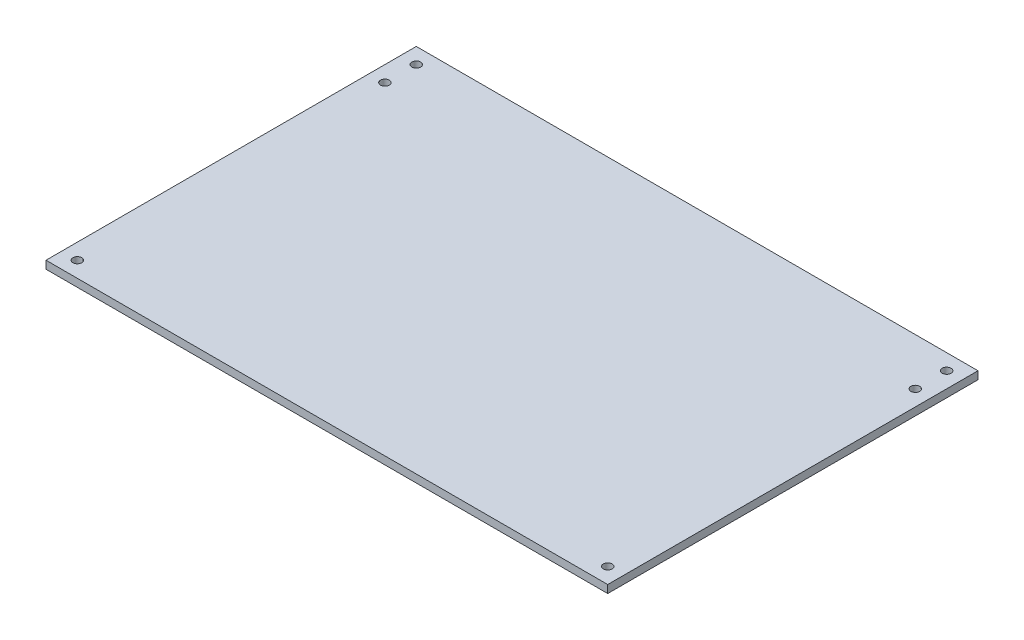
from build123d import *

# Parameters (mm, degrees)
BOSS_EXTRUDE1_START              = 19.05
SKETCH2_W                        = 600
SKETCH2_H                        = 256.45
BOSS_EXTRUDE1_DEPTH              = 6.35
BOSS_EXTRUDE2_START              = 19.05
SKETCH2_4_W                      = 455.092
SKETCH2_4_H                      = 256.45
BOSS_EXTRUDE2_DEPTH              = 6.35
BOSS_EXTRUDE3_START              = 19.05
SKETCH2_5_W                      = 455.092
SKETCH2_5_H                      = 300
BOSS_EXTRUDE3_DEPTH              = 6.35
SKETCH8_W                        = 3.5687
SKETCH8_H                        = 6.35
F_1_4_CLEARANCE_HOLE2_AT_2_COUNT = 2
F_1_4_CLEARANCE_HOLE2_AT_2_PITCH = 231.05
F_1_4_CLEARANCE_HOLE2_AT_3_COUNT = 2
F_1_4_CLEARANCE_HOLE2_AT_3_PITCH = 595.822744195
F_1_4_CLEARANCE_HOLE2_AT_4_COUNT = 2
F_1_4_CLEARANCE_HOLE2_AT_4_PITCH = 619.31354135
F_1_4_CLEARANCE_HOLE2_AT_5_COUNT = 2
F_1_4_CLEARANCE_HOLE2_AT_5_PITCH = 523.8
F_1_4_CLEARANCE_HOLE2_AT_6_COUNT = 2
F_1_4_CLEARANCE_HOLE2_AT_6_PITCH = 549.2
F_1_4_CLEARANCE_HOLE2_AT_7_COUNT = 2
F_1_4_CLEARANCE_HOLE2_AT_7_PITCH = 574.6
SKETCH10_W                       = 3.5687
SKETCH10_H                       = 6.35
F_1_4_CLEARANCE_HOLE3_AT_2_COUNT = 2
F_1_4_CLEARANCE_HOLE3_AT_2_PITCH = 25.4
F_1_4_CLEARANCE_HOLE3_AT_3_COUNT = 2
F_1_4_CLEARANCE_HOLE3_AT_3_PITCH = 50.8
F_1_4_CLEARANCE_HOLE3_AT_4_COUNT = 2
F_1_4_CLEARANCE_HOLE3_AT_4_PITCH = 231.05
F_1_4_CLEARANCE_HOLE3_AT_5_COUNT = 2
F_1_4_CLEARANCE_HOLE3_AT_5_PITCH = 487.872234672
F_1_4_CLEARANCE_HOLE3_AT_6_COUNT = 2
F_1_4_CLEARANCE_HOLE3_AT_6_PITCH = 476.368698976
F_1_4_CLEARANCE_HOLE3_AT_7_COUNT = 2
F_1_4_CLEARANCE_HOLE3_AT_7_PITCH = 429.692
SKETCH12_W                       = 3.5687
SKETCH12_H                       = 6.35
F_1_4_CLEARANCE_HOLE4_AT_2_COUNT = 2
F_1_4_CLEARANCE_HOLE4_AT_2_PITCH = 25.4
F_1_4_CLEARANCE_HOLE4_AT_3_COUNT = 2
F_1_4_CLEARANCE_HOLE4_AT_3_PITCH = 249.2
F_1_4_CLEARANCE_HOLE4_AT_4_COUNT = 2
F_1_4_CLEARANCE_HOLE4_AT_4_PITCH = 496.725130091
F_1_4_CLEARANCE_HOLE4_AT_5_COUNT = 2
F_1_4_CLEARANCE_HOLE4_AT_5_PITCH = 429.692
F_1_4_CLEARANCE_HOLE4_AT_6_COUNT = 2
F_1_4_CLEARANCE_HOLE4_AT_6_PITCH = 430.442069115
SKETCH14_W                       = 2.4892
SKETCH14_H                       = 6.35
F_8_CLEARANCE_HOLE2_AT_2_COUNT   = 2
F_8_CLEARANCE_HOLE2_AT_2_PITCH   = 128.5875
SKETCH16_W                       = 2.4892
SKETCH16_H                       = 6.35
F_8_CLEARANCE_HOLE3_AT_2_COUNT   = 2
F_8_CLEARANCE_HOLE3_AT_2_PITCH   = 128.5875
SKETCH17_R                       = 3.5687
BOSS_EXTRUDE4_DEPTH              = 6.35
FILLET2_R                        = 6.35
SKETCH18_W                       = 152.4
SKETCH18_H                       = 25.4
SKETCH18_R                       = 3.5687
BOSS_EXTRUDE5_DEPTH              = 6.35
SKETCH19_W                       = 25.4
SKETCH19_H                       = 101.6
SKETCH19_R                       = 3.5687
BOSS_EXTRUDE6_DEPTH              = 6.35


with BuildPart() as part:
    # Sketch2 → Boss-Extrude1 (new body)
    with BuildSketch(Plane(origin=(0, 0, 0), x_dir=(1, 0, 0), z_dir=(0, 1, 0)).offset(BOSS_EXTRUDE1_START)):
        with Locations((0, 278.225)):
            Rectangle(SKETCH2_W, SKETCH2_H)
    extrude(amount=BOSS_EXTRUDE1_DEPTH)

    # Sketch8 → 1/4 Clearance Hole2 (revolve, cut)
    with BuildSketch(Plane(origin=(-287.3, 25.4, -393.75), x_dir=(0, 0, 1), z_dir=(1, 0, 0))):
        with Locations((1.78435, 3.175)):
            Rectangle(SKETCH8_W, SKETCH8_H)
    f_1_4_clearance_hole2 = revolve(axis=Axis((-287.3, 31.75, -393.75), (0, -1, 0)), mode=Mode.SUBTRACT)

    # 1/4 Clearance Hole2 at 2: 1/4 Clearance Hole2 ×2
    with Locations(*[(0, 0, i * F_1_4_CLEARANCE_HOLE2_AT_2_PITCH) for i in range(1, F_1_4_CLEARANCE_HOLE2_AT_2_COUNT)]):
        add(f_1_4_clearance_hole2, mode=Mode.SUBTRACT)

    # 1/4 Clearance Hole2 at 3: 1/4 Clearance Hole2 ×2
    with Locations(*[Vector(0.9217506470687957, 0, 0.3877831154501913) * (i * F_1_4_CLEARANCE_HOLE2_AT_3_PITCH) for i in range(1, F_1_4_CLEARANCE_HOLE2_AT_3_COUNT)]):
        add(f_1_4_clearance_hole2, mode=Mode.SUBTRACT)

    # 1/4 Clearance Hole2 at 4: 1/4 Clearance Hole2 ×2
    with Locations(*[Vector(0.9278014473041833, 0, 0.37307435502894426) * (i * F_1_4_CLEARANCE_HOLE2_AT_4_PITCH) for i in range(1, F_1_4_CLEARANCE_HOLE2_AT_4_COUNT)]):
        add(f_1_4_clearance_hole2, mode=Mode.SUBTRACT)

    # 1/4 Clearance Hole2 at 5: 1/4 Clearance Hole2 ×2
    with Locations(*[(i * F_1_4_CLEARANCE_HOLE2_AT_5_PITCH, 0, 0) for i in range(1, F_1_4_CLEARANCE_HOLE2_AT_5_COUNT)]):
        add(f_1_4_clearance_hole2, mode=Mode.SUBTRACT)

    # 1/4 Clearance Hole2 at 6: 1/4 Clearance Hole2 ×2
    with Locations(*[(i * F_1_4_CLEARANCE_HOLE2_AT_6_PITCH, 0, 0) for i in range(1, F_1_4_CLEARANCE_HOLE2_AT_6_COUNT)]):
        add(f_1_4_clearance_hole2, mode=Mode.SUBTRACT)

    # 1/4 Clearance Hole2 at 7: 1/4 Clearance Hole2 ×2
    with Locations(*[(i * F_1_4_CLEARANCE_HOLE2_AT_7_PITCH, 0, 0) for i in range(1, F_1_4_CLEARANCE_HOLE2_AT_7_COUNT)]):
        add(f_1_4_clearance_hole2, mode=Mode.SUBTRACT)

    # Sketch14 → #8 Clearance Hole2 (revolve, cut)
    with BuildSketch(Plane(origin=(-268.25, 25.4, -351.68125), x_dir=(0, 0, 1), z_dir=(1, 0, 0))):
        with Locations((1.2446, 3.175)):
            Rectangle(SKETCH14_W, SKETCH14_H)
    f_8_clearance_hole2 = revolve(axis=Axis((-268.25, 31.75, -351.68125), (0, -1, 0)), mode=Mode.SUBTRACT)

    # #8 Clearance Hole2 at 2: #8 Clearance Hole2 ×2
    with Locations(*[(0, 0, i * F_8_CLEARANCE_HOLE2_AT_2_PITCH) for i in range(1, F_8_CLEARANCE_HOLE2_AT_2_COUNT)]):
        add(f_8_clearance_hole2, mode=Mode.SUBTRACT)


with BuildPart() as body_2:
    # Sketch2<4> → Boss-Extrude2 (new body)
    with BuildSketch(Plane(origin=(0, 0, 0), x_dir=(1, 0, 0), z_dir=(0, 1, 0)).offset(BOSS_EXTRUDE2_START)):
        with Locations((527.546, 278.225)):
            Rectangle(SKETCH2_4_W, SKETCH2_4_H)
    extrude(amount=BOSS_EXTRUDE2_DEPTH)

    # Sketch10 → 1/4 Clearance Hole3 (revolve, cut)
    with BuildSketch(Plane(origin=(312.7, 25.4, -393.75), x_dir=(0, 0, 1), z_dir=(1, 0, 0))):
        with Locations((1.78435, 3.175)):
            Rectangle(SKETCH10_W, SKETCH10_H)
    f_1_4_clearance_hole3 = revolve(axis=Axis((312.7, 31.75, -393.75), (0, -1, 0)), mode=Mode.SUBTRACT)

    # 1/4 Clearance Hole3 at 2: 1/4 Clearance Hole3 ×2
    with Locations(*[(i * F_1_4_CLEARANCE_HOLE3_AT_2_PITCH, 0, 0) for i in range(1, F_1_4_CLEARANCE_HOLE3_AT_2_COUNT)]):
        add(f_1_4_clearance_hole3, mode=Mode.SUBTRACT)

    # 1/4 Clearance Hole3 at 3: 1/4 Clearance Hole3 ×2
    with Locations(*[(i * F_1_4_CLEARANCE_HOLE3_AT_3_PITCH, 0, 0) for i in range(1, F_1_4_CLEARANCE_HOLE3_AT_3_COUNT)]):
        add(f_1_4_clearance_hole3, mode=Mode.SUBTRACT)

    # 1/4 Clearance Hole3 at 4: 1/4 Clearance Hole3 ×2
    with Locations(*[(0, 0, i * F_1_4_CLEARANCE_HOLE3_AT_4_PITCH) for i in range(1, F_1_4_CLEARANCE_HOLE3_AT_4_COUNT)]):
        add(f_1_4_clearance_hole3, mode=Mode.SUBTRACT)

    # 1/4 Clearance Hole3 at 5: 1/4 Clearance Hole3 ×2
    with Locations(*[Vector(0.880746985506873, 0, 0.47358710658183684) * (i * F_1_4_CLEARANCE_HOLE3_AT_5_PITCH) for i in range(1, F_1_4_CLEARANCE_HOLE3_AT_5_COUNT)]):
        add(f_1_4_clearance_hole3, mode=Mode.SUBTRACT)

    # 1/4 Clearance Hole3 at 6: 1/4 Clearance Hole3 ×2
    with Locations(*[Vector(0.9020156045595491, 0, 0.4317034272866863) * (i * F_1_4_CLEARANCE_HOLE3_AT_6_PITCH) for i in range(1, F_1_4_CLEARANCE_HOLE3_AT_6_COUNT)]):
        add(f_1_4_clearance_hole3, mode=Mode.SUBTRACT)

    # 1/4 Clearance Hole3 at 7: 1/4 Clearance Hole3 ×2
    with Locations(*[(i * F_1_4_CLEARANCE_HOLE3_AT_7_PITCH, 0, 0) for i in range(1, F_1_4_CLEARANCE_HOLE3_AT_7_COUNT)]):
        add(f_1_4_clearance_hole3, mode=Mode.SUBTRACT)

    # Sketch16 → #8 Clearance Hole3 (revolve, cut)
    with BuildSketch(Plane(origin=(723.342, 25.4, -351.68125), x_dir=(0, 0, 1), z_dir=(1, 0, 0))):
        with Locations((1.2446, 3.175)):
            Rectangle(SKETCH16_W, SKETCH16_H)
    f_8_clearance_hole3 = revolve(axis=Axis((723.342, 31.75, -351.68125), (0, -1, 0)), mode=Mode.SUBTRACT)

    # #8 Clearance Hole3 at 2: #8 Clearance Hole3 ×2
    with Locations(*[(0, 0, i * F_8_CLEARANCE_HOLE3_AT_2_PITCH) for i in range(1, F_8_CLEARANCE_HOLE3_AT_2_COUNT)]):
        add(f_8_clearance_hole3, mode=Mode.SUBTRACT)


with BuildPart() as body_3:
    # Sketch2<5> → Boss-Extrude3 (new body)
    with BuildSketch(Plane(origin=(0, 0, 0), x_dir=(1, 0, 0), z_dir=(0, 1, 0)).offset(BOSS_EXTRUDE3_START)):
        with Locations((527.546, 0)):
            Rectangle(SKETCH2_5_W, SKETCH2_5_H)
    extrude(amount=BOSS_EXTRUDE3_DEPTH)

    # Sketch12 → 1/4 Clearance Hole4 (revolve, cut)
    with BuildSketch(Plane(origin=(312.7, 25.4, -111.9), x_dir=(0, 0, 1), z_dir=(1, 0, 0))):
        with Locations((1.78435, 3.175)):
            Rectangle(SKETCH12_W, SKETCH12_H)
    f_1_4_clearance_hole4 = revolve(axis=Axis((312.7, 31.75, -111.9), (0, -1, 0)), mode=Mode.SUBTRACT)

    # 1/4 Clearance Hole4 at 2: 1/4 Clearance Hole4 ×2
    with Locations(*[(0, 0, -i * F_1_4_CLEARANCE_HOLE4_AT_2_PITCH) for i in range(1, F_1_4_CLEARANCE_HOLE4_AT_2_COUNT)]):
        add(f_1_4_clearance_hole4, mode=Mode.SUBTRACT)

    # 1/4 Clearance Hole4 at 3: 1/4 Clearance Hole4 ×2
    with Locations(*[(0, 0, i * F_1_4_CLEARANCE_HOLE4_AT_3_PITCH) for i in range(1, F_1_4_CLEARANCE_HOLE4_AT_3_COUNT)]):
        add(f_1_4_clearance_hole4, mode=Mode.SUBTRACT)

    # 1/4 Clearance Hole4 at 4: 1/4 Clearance Hole4 ×2
    with Locations(*[Vector(0.865049851456502, 0, 0.5016859121951541) * (i * F_1_4_CLEARANCE_HOLE4_AT_4_PITCH) for i in range(1, F_1_4_CLEARANCE_HOLE4_AT_4_COUNT)]):
        add(f_1_4_clearance_hole4, mode=Mode.SUBTRACT)

    # 1/4 Clearance Hole4 at 5: 1/4 Clearance Hole4 ×2
    with Locations(*[(i * F_1_4_CLEARANCE_HOLE4_AT_5_PITCH, 0, 0) for i in range(1, F_1_4_CLEARANCE_HOLE4_AT_5_COUNT)]):
        add(f_1_4_clearance_hole4, mode=Mode.SUBTRACT)

    # 1/4 Clearance Hole4 at 6: 1/4 Clearance Hole4 ×2
    with Locations(*[Vector(0.998257444685787, 0, -0.05900910208944768) * (i * F_1_4_CLEARANCE_HOLE4_AT_6_PITCH) for i in range(1, F_1_4_CLEARANCE_HOLE4_AT_6_COUNT)]):
        add(f_1_4_clearance_hole4, mode=Mode.SUBTRACT)


with BuildPart() as body_4:
    # Sketch17 → Boss-Extrude4 (new body)
    with BuildSketch(Plane(origin=(0, 25.4, 0), x_dir=(1, 0, 0), z_dir=(0, 1, 0))):
        Polygon((249.2, 150), (249.2, 175.4), (325.4, 175.4), (325.4, 99.2), (300, 99.2), (300, 150), align=None)
        with Locations(Location((261.9, 162.7, 0), (0, 0, 270))):
            Circle(SKETCH17_R, mode=Mode.SUBTRACT)
        with Locations(Location((287.3, 162.7, 0), (0, 0, 270))):
            Circle(SKETCH17_R, mode=Mode.SUBTRACT)
        with Locations(Location((312.7, 162.7, 0), (0, 0, 270))):
            Circle(SKETCH17_R, mode=Mode.SUBTRACT)
        with Locations(Location((312.7, 137.3, 0), (0, 0, 270))):
            Circle(SKETCH17_R, mode=Mode.SUBTRACT)
        with Locations(Location((312.7, 111.9, 0), (0, 0, 270))):
            Circle(SKETCH17_R, mode=Mode.SUBTRACT)
    extrude(amount=BOSS_EXTRUDE4_DEPTH)

    # Fillet2
    fillet2_edges = [body_4.edges().sort_by_distance(p)[0] for p in [
        (249.2, 28.575, -150),
        (249.2, 28.575, -175.4),
        (325.4, 28.575, -175.4),
        (325.4, 28.575, -99.2),
        (300, 28.575, -99.2),
    ]]
    fillet(fillet2_edges, radius=FILLET2_R)


with BuildPart() as body_5:
    # Sketch18 → Boss-Extrude5 (new body)
    with BuildSketch(Plane(origin=(0, 25.4, 0), x_dir=(1, 0, 0), z_dir=(0, 1, 0))):
        with Locations((300, 393.75)):
            Rectangle(SKETCH18_W, SKETCH18_H)
        with Locations(Location((236.5, 393.75, 0), (0, 0, 270))):
            Circle(SKETCH18_R, mode=Mode.SUBTRACT)
        with Locations(Location((261.9, 393.75, 0), (0, 0, 270))):
            Circle(SKETCH18_R, mode=Mode.SUBTRACT)
        with Locations(Location((287.3, 393.75, 0), (0, 0, 270))):
            Circle(SKETCH18_R, mode=Mode.SUBTRACT)
        with Locations(Location((312.7, 393.75, 0), (0, 0, 270))):
            Circle(SKETCH18_R, mode=Mode.SUBTRACT)
        with Locations(Location((338.1, 393.75, 0), (0, 0, 270))):
            Circle(SKETCH18_R, mode=Mode.SUBTRACT)
        with Locations(Location((363.5, 393.75, 0), (0, 0, 270))):
            Circle(SKETCH18_R, mode=Mode.SUBTRACT)
    extrude(amount=BOSS_EXTRUDE5_DEPTH)


with BuildPart() as body_6:
    # Sketch19 → Boss-Extrude6 (new body)
    with BuildSketch(Plane(origin=(0, 25.4, 0), x_dir=(1, 0, 0), z_dir=(0, 1, 0))):
        with Locations((742.392, 150)):
            Rectangle(SKETCH19_W, SKETCH19_H)
        with Locations(Location((742.392, 111.9, 0), (0, 0, 270))):
            Circle(SKETCH19_R, mode=Mode.SUBTRACT)
        with Locations(Location((742.392, 137.3, 0), (0, 0, 270))):
            Circle(SKETCH19_R, mode=Mode.SUBTRACT)
        with Locations((742.392, 162.7)):
            Circle(SKETCH19_R, mode=Mode.SUBTRACT)
        with Locations((742.392, 188.1)):
            Circle(SKETCH19_R, mode=Mode.SUBTRACT)
    extrude(amount=BOSS_EXTRUDE6_DEPTH)


solid = body_3.part
